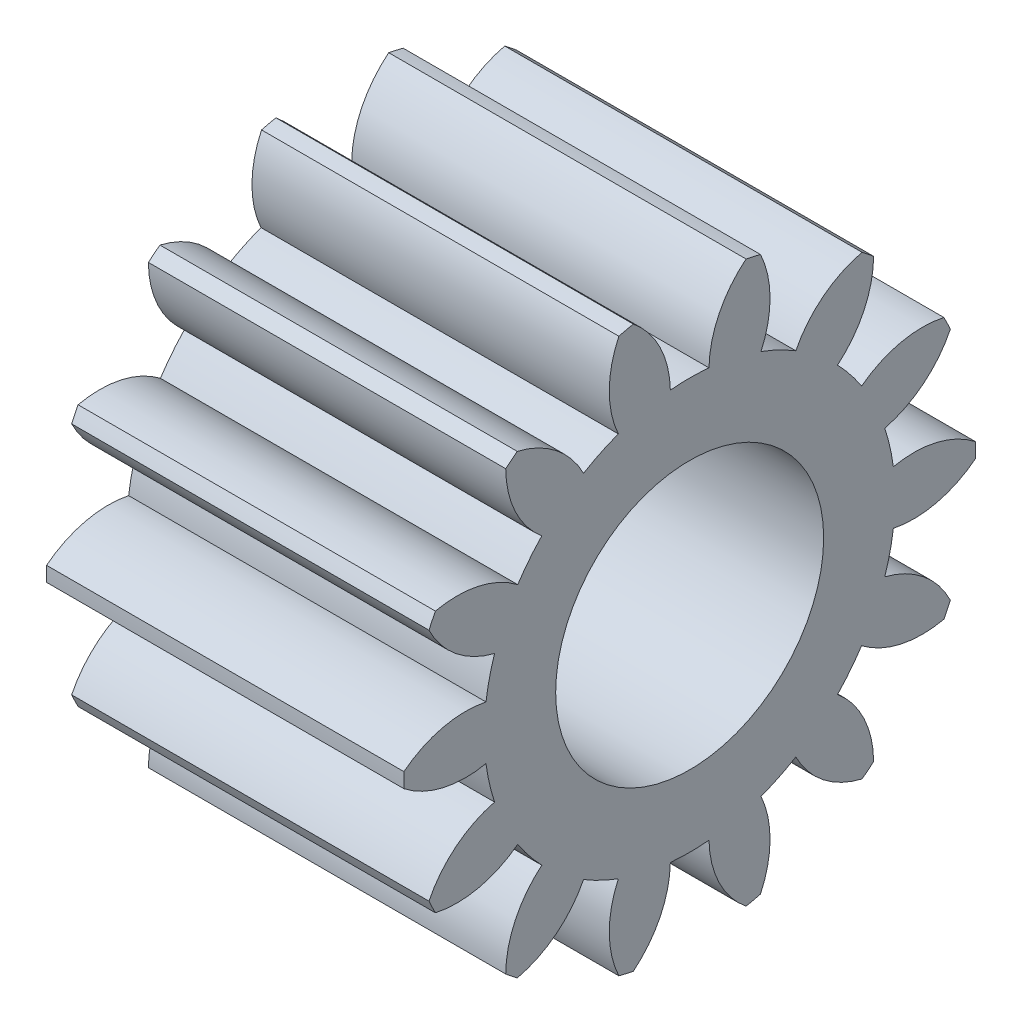
from build123d import *

# Parameters (mm, degrees)
BASPROSKE_W             = 10
BASPROSKE_H             = 8
TOOTHCUT_DEPTH          = 16.099668871
TEETHCUTS_COUNT         = 14
TEETHCUTS_ANGLE         = 334.285714286
BORSKE_R                = 0.5
BORE_DEPTH              = 50.0000508
CUT_EXTRUDE1_DEPTH      = 16.017018917
CUT_EXTRUDE2_DEPTH      = 16.017018917
CUT_EXTRUDE2_DEPTH_BACK = 16.017018917
SKETCH2_R               = 3.75


with BuildPart() as part:
    # BasProSke → Base-Revolve (revolve)
    with BuildSketch(Plane(origin=(0, 0, 0), x_dir=(1, 0, 0), z_dir=(0, 1, 0)), mode=Mode.PRIVATE) as base_revolve_sk:
        with Locations((5, 4)):
            Rectangle(BASPROSKE_W, BASPROSKE_H)
    revolve(base_revolve_sk.sketch.rotate(Axis((-10, 0, 0), (1, 0, 0)), 180), axis=Axis((-10, 0, 0), (1, 0, 0)))

    # TooCutSke → ToothCut (cut, through all)
    with BuildSketch(Plane(origin=(0, 0, 0), x_dir=(0, 0, -1), z_dir=(1, 0, 0))):
        with BuildLine():
            ThreePointArc((0.540393256, 5.723545765), (0, 5.749), (-0.540393256, 5.723545765))
            ThreePointArc((-0.540393256, 5.723545765), (-0.832220085, 6.912663993), (-1.603550271, 7.863566092))
            ThreePointArc((-1.603550271, 7.863566092), (0, 8.0254), (1.603550271, 7.863566092))
            ThreePointArc((1.603550271, 7.863566092), (0.832220085, 6.912663993), (0.540393256, 5.723545765))
        make_face()
    toothcut = extrude(amount=TOOTHCUT_DEPTH, mode=Mode.SUBTRACT)

    # TeethCuts: ToothCut ×14 about axis
    teethcuts_axis = Axis((-10, 0, 0), (1, 0, 0))
    for i in range(1, TEETHCUTS_COUNT):
        add(toothcut.rotate(teethcuts_axis, i * TEETHCUTS_ANGLE / (TEETHCUTS_COUNT - 1)), mode=Mode.SUBTRACT)

    # BorSke → Bore (cut, symmetric)
    with BuildSketch(Plane(origin=(0, 0, 0), x_dir=(0, 0, -1), z_dir=(1, 0, 0))):
        with Locations(Location((0, 0, 0), (0, 0, 180))):
            Circle(BORSKE_R)
    extrude(amount=BORE_DEPTH, both=True, mode=Mode.SUBTRACT)

    # Sketch1 → Cut-Extrude1 (cut, through all)
    with BuildSketch(Plane(origin=(10, 0, 0), x_dir=(0, 0, -1), z_dir=(1, 0, 0))):
        Polygon((-1.125, -1.125), (-1.125, -3.375), (1.125, -3.375), (1.125, -1.125), (3.375, -1.125), (3.375, 1.125), (1.125, 1.125), (1.125, 3.375), (-1.125, 3.375), (-1.125, 1.125), (-3.375, 1.125), (-3.375, -1.125), align=None)
    extrude(amount=-CUT_EXTRUDE1_DEPTH, mode=Mode.SUBTRACT)

    # Sketch2 → Cut-Extrude2 (cut, two sides: drawn at the far end of the back side and taken through both)
    with BuildSketch(Plane(origin=(10, 0, 0), x_dir=(0, 0, -1), z_dir=(1, 0, 0)).offset(-CUT_EXTRUDE2_DEPTH_BACK)):
        Circle(SKETCH2_R)
    extrude(amount=CUT_EXTRUDE2_DEPTH + CUT_EXTRUDE2_DEPTH_BACK, mode=Mode.SUBTRACT)


solid = part.part
